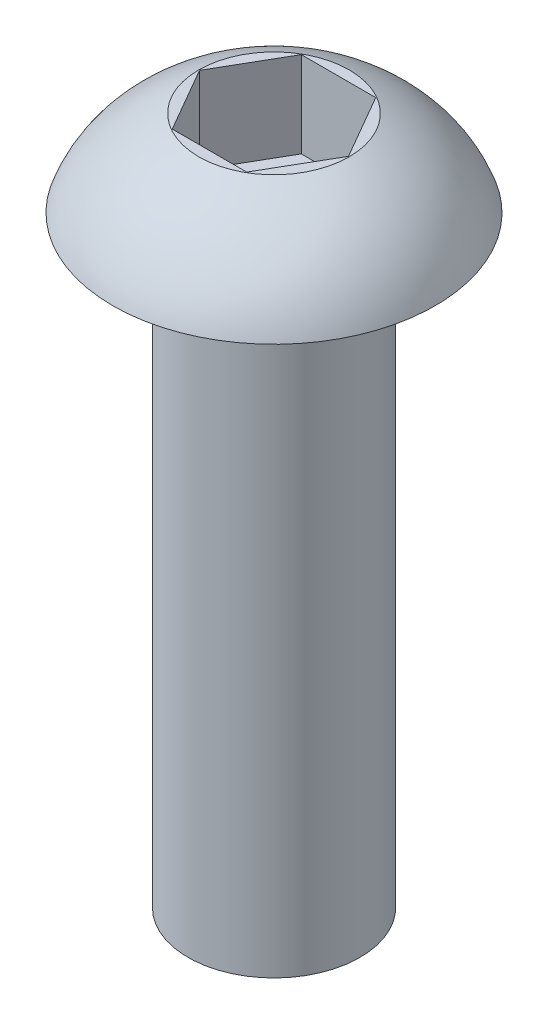
from build123d import *

# Parameters (mm, degrees)
SKETCH15_W           = 2
SKETCH15_H           = 14
SKETCH19_R           = 1.75
BOSS_EXTRUDE11_DEPTH = 2


with BuildPart() as part:
    # Sketch15 → Revolve3 (revolve)
    with BuildSketch(Plane(origin=(0, 0, 0), x_dir=(0, 0, -1), z_dir=(1, 0, 0))):
        Rectangle(SKETCH15_W, SKETCH15_H)
        with BuildLine():
            Line((0.75, 9), (0.75, 7))
            Line((0.75, 7), (1, 7))
            Line((1, 7), (2.75, 7))
            add(Edge.make_bspline(
                [(0.75, 9), (2.290975881, 8.319572534), (2.75, 7)],
                knots=[0, 0, 0, 0.856055689, 0.856055689, 0.856055689], degree=2))
        make_face()
    revolve(axis=Axis((0, -7, 1), (0, 1, 0)))

    # Sketch19 → Boss-Extrude11 (add)
    with BuildSketch(Plane(origin=(0, 7, 0), x_dir=(1, 0, 0), z_dir=(0, 1, 0))):
        with Locations((0, -1)):
            Circle(SKETCH19_R)
        Polygon((1.732050808, -1), (0.866025404, 0.5), (-0.866025404, 0.5), (-1.732050808, -1), (-0.866025404, -2.5), (0.866025404, -2.5), align=None, mode=Mode.SUBTRACT)
    extrude(amount=BOSS_EXTRUDE11_DEPTH)


solid = part.part
